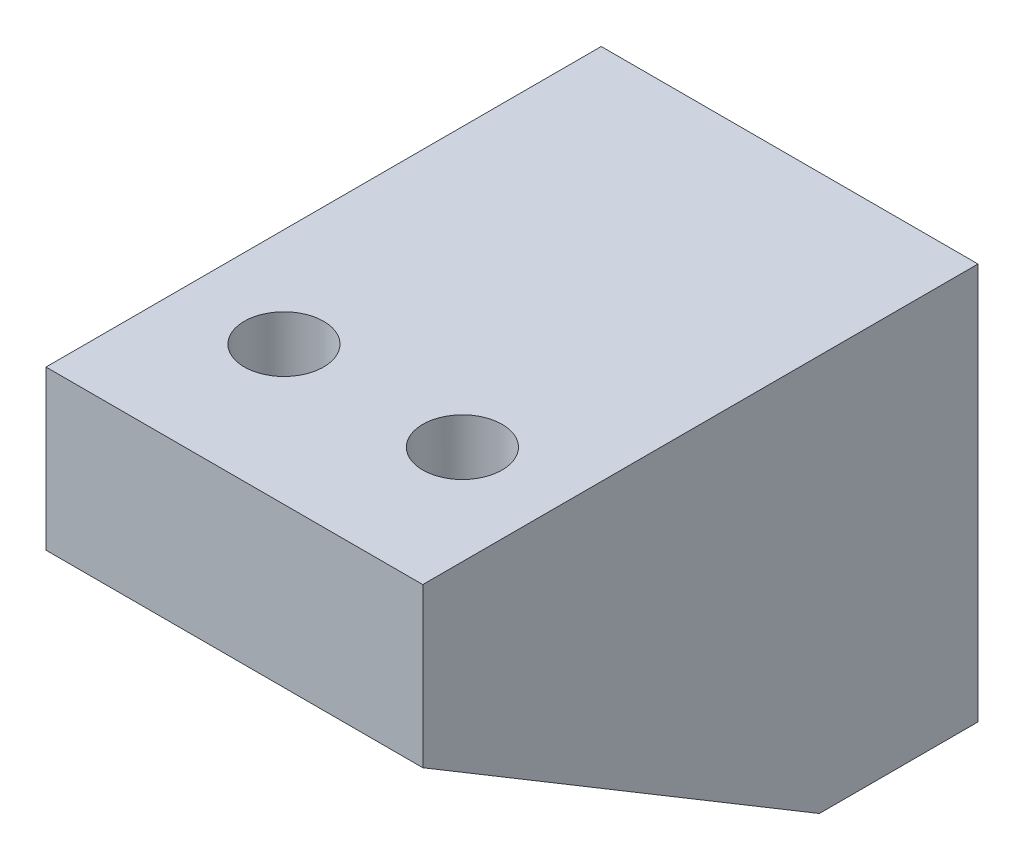
from build123d import *

# Parameters (mm, degrees)
SKETCH1_W           = 19
SKETCH1_H           = 20
BOSS_EXTRUDE1_DEPTH = 8
SKETCH2_W           = 19
SKETCH2_H           = 8
BOSS_EXTRUDE2_DEPTH = 20
SKETCH3_R           = 2
CUT_EXTRUDE1_DEPTH  = 20
SKETCH4_R           = 2
CUT_EXTRUDE2_DEPTH  = 20
BOSS_EXTRUDE3_DEPTH = 19
SKETCH7_R           = 3.5
CUT_EXTRUDE3_DEPTH  = 20
SKETCH8_R           = 3.5
CUT_EXTRUDE4_DEPTH  = 20


with BuildPart() as part:
    # Sketch1 → Boss-Extrude1 (new body)
    with BuildSketch(Plane.XY):
        with Locations((-3.134342089, 6.179897069)):
            Rectangle(SKETCH1_W, SKETCH1_H)
    extrude(amount=BOSS_EXTRUDE1_DEPTH)

    # Sketch2 → Boss-Extrude2 (add)
    with BuildSketch(Plane.XY.offset(8)):
        with Locations((-3.134342089, 12.179897069)):
            Rectangle(SKETCH2_W, SKETCH2_H)
    extrude(amount=BOSS_EXTRUDE2_DEPTH)

    # Sketch3 → Cut-Extrude1 (cut)
    with BuildSketch(Plane.XY.offset(8)):
        with Locations((-8.634342089, 1.179897069)):
            Circle(SKETCH3_R)
        with Locations((2.365657911, 1.179897069)):
            Circle(SKETCH3_R)
    extrude(amount=-CUT_EXTRUDE1_DEPTH, mode=Mode.SUBTRACT)

    # Sketch4 → Cut-Extrude2 (cut)
    with BuildSketch(Plane.XZ.offset(-8.179897069)):
        with Locations(Location((-7.634342089, 21, 0), (0, 0, 270))):
            Circle(SKETCH4_R)
        with Locations(Location((1.365657911, 21, 0), (0, 0, 270))):
            Circle(SKETCH4_R)
    extrude(amount=-CUT_EXTRUDE2_DEPTH, mode=Mode.SUBTRACT)

    # Sketch5 → Boss-Extrude3 (add)
    with BuildSketch(Plane.ZY.offset(12.634342089)):
        Polygon((28, 8.179897069), (8, -3.820102931), (8, 8.179897069), align=None)
    extrude(amount=-BOSS_EXTRUDE3_DEPTH)

    # Sketch7 → Cut-Extrude3 (cut)
    with BuildSketch(Plane(origin=(0, 8.179897069, 0), x_dir=(1, 0, 0), z_dir=(0, 1, 0))):
        with Locations(Location((1.365657911, -21, 0), (0, 0, 180))):
            Circle(SKETCH7_R)
        with Locations(Location((-7.634342089, -21, 0), (0, 0, 180))):
            Circle(SKETCH7_R)
    extrude(amount=-CUT_EXTRUDE3_DEPTH, mode=Mode.SUBTRACT)

    # Sketch8 → Cut-Extrude4 (cut)
    with BuildSketch(Plane(origin=(0, 0, 8), x_dir=(-1, 0, 0), z_dir=(0, 0, -1))):
        with Locations((8.634342089, 1.179897069)):
            Circle(SKETCH8_R)
        with Locations((-2.365657911, 1.179897069)):
            Circle(SKETCH8_R)
    extrude(amount=-CUT_EXTRUDE4_DEPTH, mode=Mode.SUBTRACT)


solid = part.part
